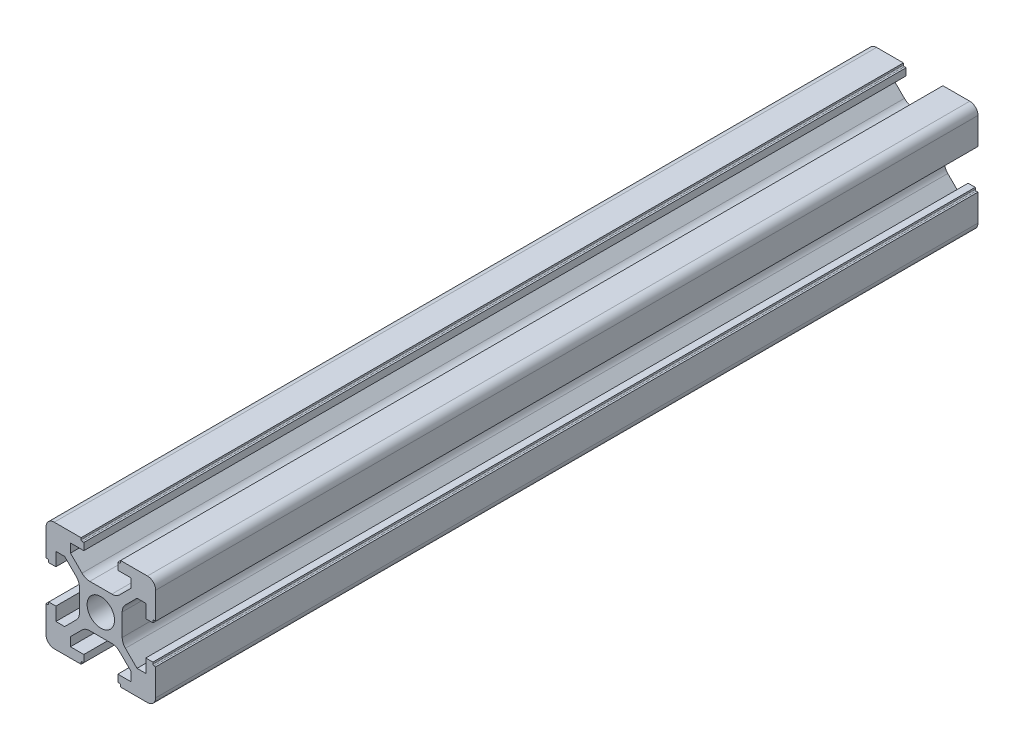
from build123d import *

# Parameters (mm, degrees)
SKETCH1_R      = 2.5
EXTRUDE1_DEPTH = 150


with BuildPart() as part:
    # Sketch1 → Extrude1 (new body)
    with BuildSketch(Plane.XY):
        with BuildLine():
            Line((0, 3.9), (-2.010912703, 3.9))
            ThreePointArc((-2.010912703, 3.9), (-2.776279568, 4.052240935), (-3.425126266, 4.485786438))
            Line((-3.425126266, 4.485786438), (-5.539339828, 6.6))
            Line((-5.539339828, 6.6), (-5.539339828, 8.2))
            Line((-5.539339828, 8.2), (-3.1, 8.2))
            Line((-3.1, 8.2), (-3.1, 9.5))
            Line((-3.1, 9.5), (-3.4, 9.5))
            ThreePointArc((-3.4, 9.5), (-3.541421356, 9.558578644), (-3.6, 9.7))
            Line((-3.6, 9.7), (-3.6, 10))
            Line((-3.6, 10), (-8.5, 10))
            ThreePointArc((-8.5, 10), (-9.560660172, 9.560660172), (-10, 8.5))
            Line((-10, 8.5), (-10, 3.6))
            Line((-10, 3.6), (-9.7, 3.6))
            ThreePointArc((-9.7, 3.6), (-9.558578644, 3.541421356), (-9.5, 3.4))
            Line((-9.5, 3.4), (-9.5, 3.1))
            Line((-9.5, 3.1), (-8.2, 3.1))
            Line((-8.2, 3.1), (-8.2, 5.539339828))
            Line((-8.2, 5.539339828), (-6.6, 5.539339828))
            Line((-6.6, 5.539339828), (-4.485786438, 3.425126266))
            ThreePointArc((-4.485786438, 3.425126266), (-4.052240935, 2.776279568), (-3.9, 2.010912703))
            Line((-3.9, 2.010912703), (-3.9, 0))
            Line((-3.9, 0), (-3.9, -2.010912703))
            ThreePointArc((-3.9, -2.010912703), (-4.052240935, -2.776279568), (-4.485786438, -3.425126266))
            Line((-4.485786438, -3.425126266), (-6.6, -5.539339828))
            Line((-6.6, -5.539339828), (-8.2, -5.539339828))
            Line((-8.2, -5.539339828), (-8.2, -3.1))
            Line((-8.2, -3.1), (-9.5, -3.1))
            Line((-9.5, -3.1), (-9.5, -3.4))
            ThreePointArc((-9.5, -3.4), (-9.558578644, -3.541421356), (-9.7, -3.6))
            Line((-9.7, -3.6), (-10, -3.6))
            Line((-10, -3.6), (-10, -8.5))
            ThreePointArc((-10, -8.5), (-9.560660172, -9.560660172), (-8.5, -10))
            Line((-8.5, -10), (-3.6, -10))
            Line((-3.6, -10), (-3.6, -9.7))
            ThreePointArc((-3.6, -9.7), (-3.541421356, -9.558578644), (-3.4, -9.5))
            Line((-3.4, -9.5), (-3.1, -9.5))
            Line((-3.1, -9.5), (-3.1, -8.2))
            Line((-3.1, -8.2), (-5.539339828, -8.2))
            Line((-5.539339828, -8.2), (-5.539339828, -6.6))
            Line((-5.539339828, -6.6), (-3.425126266, -4.485786438))
            ThreePointArc((-3.425126266, -4.485786438), (-2.776279568, -4.052240935), (-2.010912703, -3.9))
            Line((-2.010912703, -3.9), (0, -3.9))
            Line((0, -3.9), (2.010912703, -3.9))
            ThreePointArc((2.010912703, -3.9), (2.776279568, -4.052240935), (3.425126266, -4.485786438))
            Line((3.425126266, -4.485786438), (5.539339828, -6.6))
            Line((5.539339828, -6.6), (5.539339828, -8.2))
            Line((5.539339828, -8.2), (3.1, -8.2))
            Line((3.1, -8.2), (3.1, -9.5))
            Line((3.1, -9.5), (3.4, -9.5))
            ThreePointArc((3.4, -9.5), (3.541421356, -9.558578644), (3.6, -9.7))
            Line((3.6, -9.7), (3.6, -10))
            Line((3.6, -10), (8.5, -10))
            ThreePointArc((8.5, -10), (9.560660172, -9.560660172), (10, -8.5))
            Line((10, -8.5), (10, -3.6))
            Line((10, -3.6), (9.7, -3.6))
            ThreePointArc((9.7, -3.6), (9.558578644, -3.541421356), (9.5, -3.4))
            Line((9.5, -3.4), (9.5, -3.1))
            Line((9.5, -3.1), (8.2, -3.1))
            Line((8.2, -3.1), (8.2, -5.539339828))
            Line((8.2, -5.539339828), (6.6, -5.539339828))
            Line((6.6, -5.539339828), (4.485786438, -3.425126266))
            ThreePointArc((4.485786438, -3.425126266), (4.052240935, -2.776279568), (3.9, -2.010912703))
            Line((3.9, -2.010912703), (3.9, 0))
            Line((3.9, 0), (3.9, 2.010912703))
            ThreePointArc((3.9, 2.010912703), (4.052240935, 2.776279568), (4.485786438, 3.425126266))
            Line((4.485786438, 3.425126266), (6.6, 5.539339828))
            Line((6.6, 5.539339828), (8.2, 5.539339828))
            Line((8.2, 5.539339828), (8.2, 3.1))
            Line((8.2, 3.1), (9.5, 3.1))
            Line((9.5, 3.1), (9.5, 3.4))
            ThreePointArc((9.5, 3.4), (9.558578644, 3.541421356), (9.7, 3.6))
            Line((9.7, 3.6), (10, 3.6))
            Line((10, 3.6), (10, 8.5))
            ThreePointArc((10, 8.5), (9.560660172, 9.560660172), (8.5, 10))
            Line((8.5, 10), (3.6, 10))
            Line((3.6, 10), (3.6, 9.7))
            ThreePointArc((3.6, 9.7), (3.541421356, 9.558578644), (3.4, 9.5))
            Line((3.4, 9.5), (3.1, 9.5))
            Line((3.1, 9.5), (3.1, 8.2))
            Line((3.1, 8.2), (5.539339828, 8.2))
            Line((5.539339828, 8.2), (5.539339828, 6.6))
            Line((5.539339828, 6.6), (3.425126266, 4.485786438))
            ThreePointArc((3.425126266, 4.485786438), (2.776279568, 4.052240935), (2.010912703, 3.9))
            Line((2.010912703, 3.9), (0, 3.9))
        make_face()
        Circle(SKETCH1_R, mode=Mode.SUBTRACT)
    extrude(amount=EXTRUDE1_DEPTH)


solid = part.part
